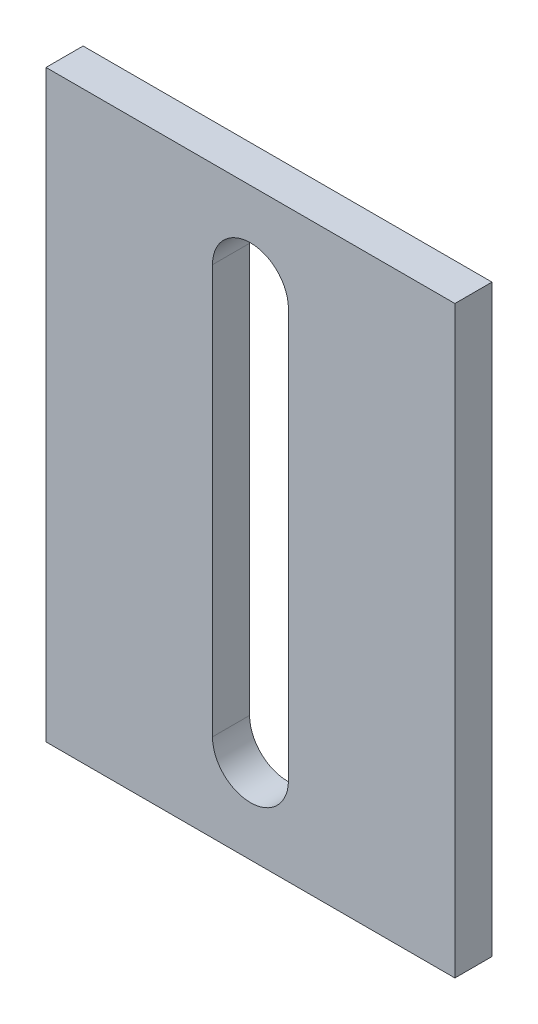
from build123d import *

# Parameters (mm, degrees)
CROQUIS1_W              = 70
CROQUIS1_H              = 100
SALIENTE_EXTRUIR1_DEPTH = 6.35


with BuildPart() as part:
    # Croquis1 → Saliente-Extruir1 (new body)
    with BuildSketch(Plane.XY):
        Rectangle(CROQUIS1_W, CROQUIS1_H)
        with BuildLine():
            Line((-6.5, -35), (-6.5, 35))
            ThreePointArc((-6.5, 35), (0, 41.5), (6.5, 35))
            Line((6.5, 35), (6.5, -35))
            ThreePointArc((6.5, -35), (0, -41.5), (-6.5, -35))
        make_face(mode=Mode.SUBTRACT)
    extrude(amount=SALIENTE_EXTRUIR1_DEPTH)


solid = part.part
